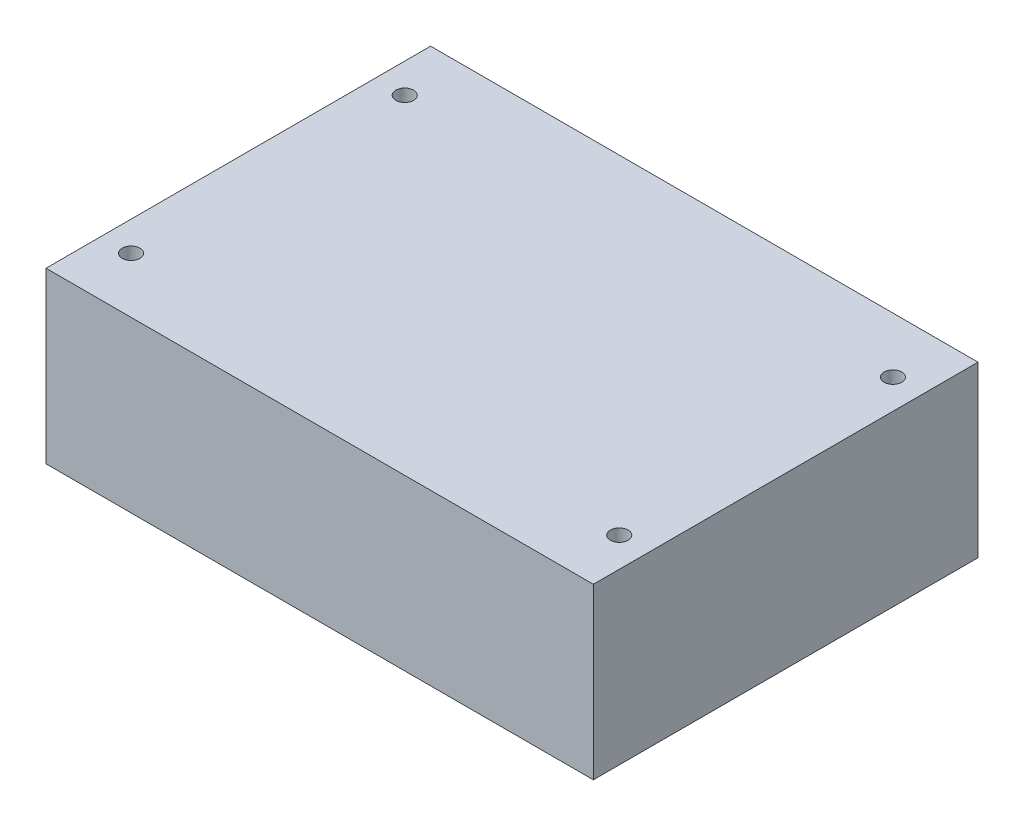
from build123d import *

# Parameters (mm, degrees)
CROQUIS1_W                       = 74
CROQUIS1_H                       = 52
SALIENTE_EXTRUIR1_DEPTH          = 22.9
TALADRO_DE_MARGEN_PARA_M21_D     = 2.4
TALADRO_DE_MARGEN_PARA_M21_DEPTH = 2.5
TALADRO_DE_MARGEN_PARA_M21_TIP   = 0.721032743


with BuildPart() as part:
    # Croquis1 → Saliente-Extruir1 (new body)
    with BuildSketch(Plane(origin=(0, 11, 0), x_dir=(1, 0, 0), z_dir=(0, 1, 0))):
        with Locations((37, 26)):
            Rectangle(CROQUIS1_W, CROQUIS1_H)
    extrude(amount=SALIENTE_EXTRUIR1_DEPTH)

    # Taladro de margen para M21
    with Locations(Plane(origin=(0, 33.9, 0), x_dir=(1, 0, 0), z_dir=(0, 1, 0))):
        with Locations((4, 44.5), (70, 44.5), (70, 7.5), (4, 7.5)):
            Hole(TALADRO_DE_MARGEN_PARA_M21_D / 2, depth=TALADRO_DE_MARGEN_PARA_M21_DEPTH)
            with Locations((0, 0, -(TALADRO_DE_MARGEN_PARA_M21_DEPTH + TALADRO_DE_MARGEN_PARA_M21_TIP / 2))):  # 118° drill point
                Cone(0, TALADRO_DE_MARGEN_PARA_M21_D / 2, TALADRO_DE_MARGEN_PARA_M21_TIP, mode=Mode.SUBTRACT)


solid = part.part
